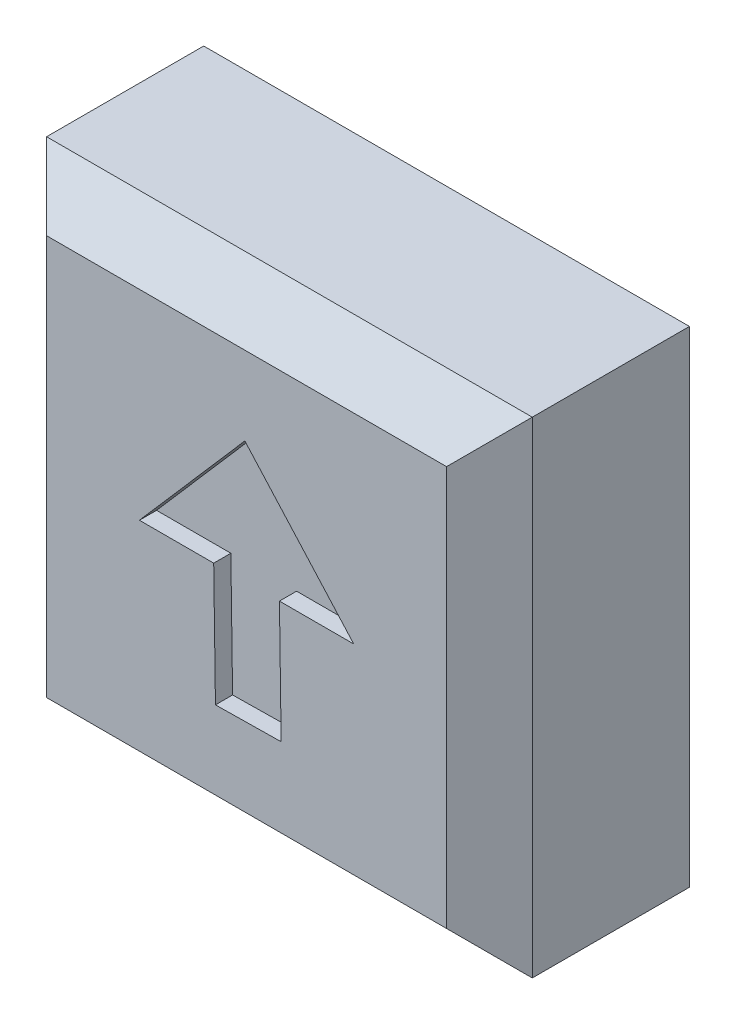
from build123d import *
from OCP.BRepFilletAPI import BRepFilletAPI_MakeChamfer

# Parameters (mm, degrees)
SKETCH1_R           = 2.75
BOSS_EXTRUDE1_DEPTH = 4
SKETCH2_W           = 17
SKETCH2_H           = 17
BOSS_EXTRUDE2_DEPTH = 1
SKETCH3_W           = 17
SKETCH3_H           = 17
SKETCH3_W_2         = 15
SKETCH3_H_2         = 15
BOSS_EXTRUDE3_DEPTH = 6
CHAMFER1_SIZE       = 1.5
CHAMFER2_SIZE       = 4
CHAMFER2_SIZE2      = 0.5
CUT_EXTRUDE1_DEPTH  = 0.6
BOSS_EXTRUDE4_START = 0.5
SKETCH5_W           = 14.989533589
SKETCH5_H           = 15
SKETCH5_R           = 2.75
BOSS_EXTRUDE4_DEPTH = 0.5


with BuildPart() as part:
    # Sketch1 → Boss-Extrude1 (new body)
    with BuildSketch(Plane(origin=(0, 0, 0), x_dir=(0, 1, 0), z_dir=(0, 0, 1))):
        with Locations(Location((0, 0, 0), (0, 0, 270))):
            Circle(SKETCH1_R)
        Polygon((-0.7, -0.625), (-2.1, -0.625), (-2.1, 0.625), (-0.7, 0.625), (-0.7, 2.1), (0.7, 2.1), (0.7, 0.625), (2.1, 0.625), (2.1, -0.625), (0.7, -0.625), (0.7, -2.1), (-0.7, -2.1), align=None, mode=Mode.SUBTRACT)
    extrude(amount=BOSS_EXTRUDE1_DEPTH)

    # Sketch2 → Boss-Extrude2 (add)
    with BuildSketch(Plane.XY.offset(4)):
        Rectangle(SKETCH2_W, SKETCH2_H)
    extrude(amount=BOSS_EXTRUDE2_DEPTH)

    # Sketch3 → Boss-Extrude3 (add)
    with BuildSketch(Plane(origin=(0, 0, 4), x_dir=(1, 0, 0), z_dir=(0, 0, -1))):
        Rectangle(SKETCH3_W, SKETCH3_H)
        Rectangle(SKETCH3_W_2, SKETCH3_H_2, mode=Mode.SUBTRACT)
    extrude(amount=BOSS_EXTRUDE3_DEPTH)

    # Chamfer1
    chamfer1_edges = [part.edges().sort_by_distance(p)[0] for p in [
        (8.5, 0, 5),
        (0, 8.5, 5),
        (-8.5, 0, 5),
        (0, -8.5, 5),
        (-2.75, 0, 4),
        (0, -7.5, 4),
        (7.5, 0, 4),
        (-7.5, 0, 4),
        (0, 7.5, 4),
    ]]
    chamfer(chamfer1_edges, length=CHAMFER1_SIZE)

    # Chamfer2: one chamfer whose edges measure the first distance from different faces: ONE call of the kernel's chamfer builder (chamfer() names one face for all edges)
    chamfer2_edges_1 = [part.edges().sort_by_distance(p)[0] for p in [
        (-7.5, 0, -2),
    ]]
    chamfer2_side_1 = [part.faces().sort_by_distance(p)[0] for p in [
        (-7.5, 0, 0.25),
    ]]
    chamfer2_edges_2 = [part.edges().sort_by_distance(p)[0] for p in [
        (0, 7.5, -2),
    ]]
    chamfer2_side_2 = [part.faces().sort_by_distance(p)[0] for p in [
        (0, 7.5, 0.25),
    ]]
    chamfer2_edges_3 = [part.edges().sort_by_distance(p)[0] for p in [
        (0, -7.5, -2),
    ]]
    chamfer2_side_3 = [part.faces().sort_by_distance(p)[0] for p in [
        (0, -7.5, 0.25),
    ]]
    chamfer2_edges_4 = [part.edges().sort_by_distance(p)[0] for p in [
        (7.5, 0, -2),
    ]]
    chamfer2_side_4 = [part.faces().sort_by_distance(p)[0] for p in [
        (7.5, 0, 0.25),
    ]]
    chamfer2 = BRepFilletAPI_MakeChamfer(part.part.solid().wrapped)
    for e in chamfer2_edges_1:
        chamfer2.Add(CHAMFER2_SIZE, CHAMFER2_SIZE2, e.wrapped, chamfer2_side_1[0].wrapped)  # the first distance lies on this face
    for e in chamfer2_edges_2:
        chamfer2.Add(CHAMFER2_SIZE, CHAMFER2_SIZE2, e.wrapped, chamfer2_side_2[0].wrapped)  # the first distance lies on this face
    for e in chamfer2_edges_3:
        chamfer2.Add(CHAMFER2_SIZE, CHAMFER2_SIZE2, e.wrapped, chamfer2_side_3[0].wrapped)  # the first distance lies on this face
    for e in chamfer2_edges_4:
        chamfer2.Add(CHAMFER2_SIZE, CHAMFER2_SIZE2, e.wrapped, chamfer2_side_4[0].wrapped)  # the first distance lies on this face
    add(Compound.cast(chamfer2.Shape()), mode=Mode.REPLACE)

    # Sketch4 → Cut-Extrude1 (cut)
    with BuildSketch(Plane.XY.offset(5)):
        Polygon((-0.06051573, 4.249569137), (-1.192187018, 2.946103658), (-1.166609713, 1.15), (1.133856704, 1.15), (1.108279399, 2.946103658), align=None)
        Polygon((-1.166609713, 1.15), (-1.192187018, 2.946103658), (-2.751567741, 1.15), align=None)
        Polygon((-1.150233209, 0), (-1.166609713, 1.15), (-2.751567741, 1.15), (-3.75, 0), align=None)
        Polygon((1.133856704, 1.15), (-1.166609713, 1.15), (-1.150233209, 0), (1.150233209, 0), align=None)
        Polygon((2.718814732, 1.15), (1.108279399, 2.946103658), (1.133856704, 1.15), align=None)
        Polygon((2.718814732, 1.15), (1.133856704, 1.15), (1.150233209, 0), (3.75, 0), align=None)
        Polygon((1.166609713, -1.15), (-1.133856704, -1.15), (-1.08948427, -4.265945641), (1.21051573, -4.233192632), align=None)
        Polygon((1.150233209, 0), (-1.150233209, 0), (-1.133856704, -1.15), (1.166609713, -1.15), align=None)
    extrude(amount=-CUT_EXTRUDE1_DEPTH, mode=Mode.SUBTRACT)

    # Sketch5 → Boss-Extrude4 (add)
    with BuildSketch(Plane(origin=(0, 0, 4), x_dir=(1, 0, 0), z_dir=(0, 0, -1)).offset(BOSS_EXTRUDE4_START)):
        with Locations((-0.005233206, 0)):
            Rectangle(SKETCH5_W, SKETCH5_H)
        with Locations(Location((0, 0, 0), (0, 0, 180))):
            Circle(SKETCH5_R, mode=Mode.SUBTRACT)
    extrude(amount=-BOSS_EXTRUDE4_DEPTH)


solid = part.part
